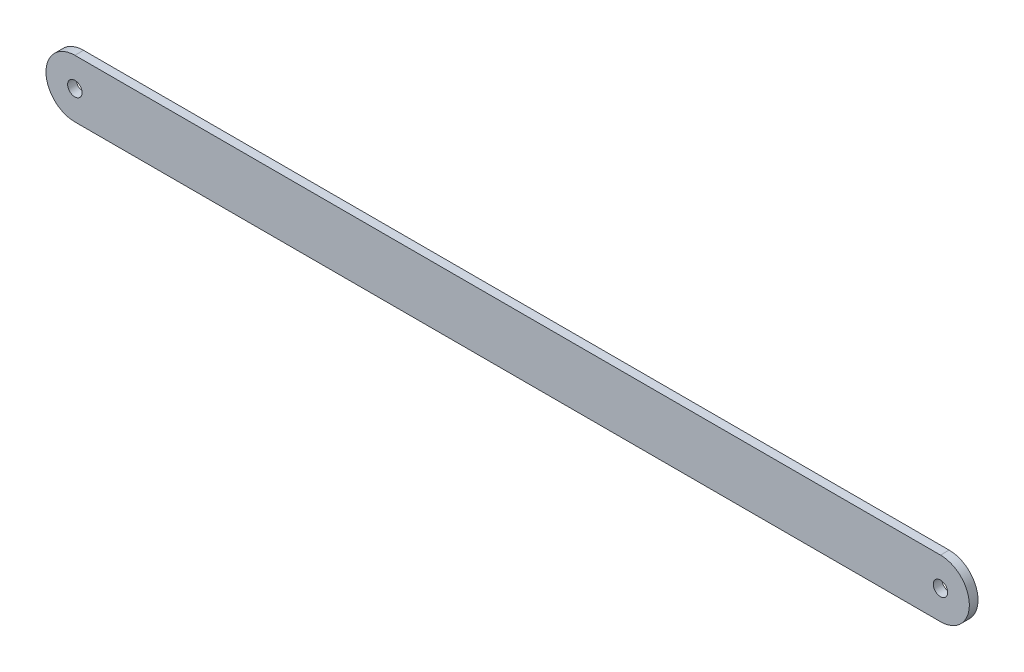
from build123d import *

# Parameters (mm, degrees)
EXTRUDE_1_DEPTH     = 3
SKETCH_2_R          = 2.5
CUT_EXTRUDE_1_DEPTH = 3


with BuildPart() as part:
    # 草图1 → 凸台-拉伸1 (new body)
    with BuildSketch(Plane.XY):
        with BuildLine():
            Line((-150, 10), (150, 10))
            ThreePointArc((150, 10), (160, 0), (150, -10))
            Line((150, -10), (-150, -10))
            ThreePointArc((-150, -10), (-160, 0), (-150, 10))
        make_face()
    extrude(amount=EXTRUDE_1_DEPTH)

    # 草图2 → 切除-拉伸1 (cut)
    with BuildSketch(Plane(origin=(0, 0, 0), x_dir=(-1, 0, 0), z_dir=(0, 0, -1))):
        with Locations((150, 0)):
            Circle(SKETCH_2_R)
        with Locations((-150, 0)):
            Circle(SKETCH_2_R)
    extrude(amount=-CUT_EXTRUDE_1_DEPTH, mode=Mode.SUBTRACT)


solid = part.part
